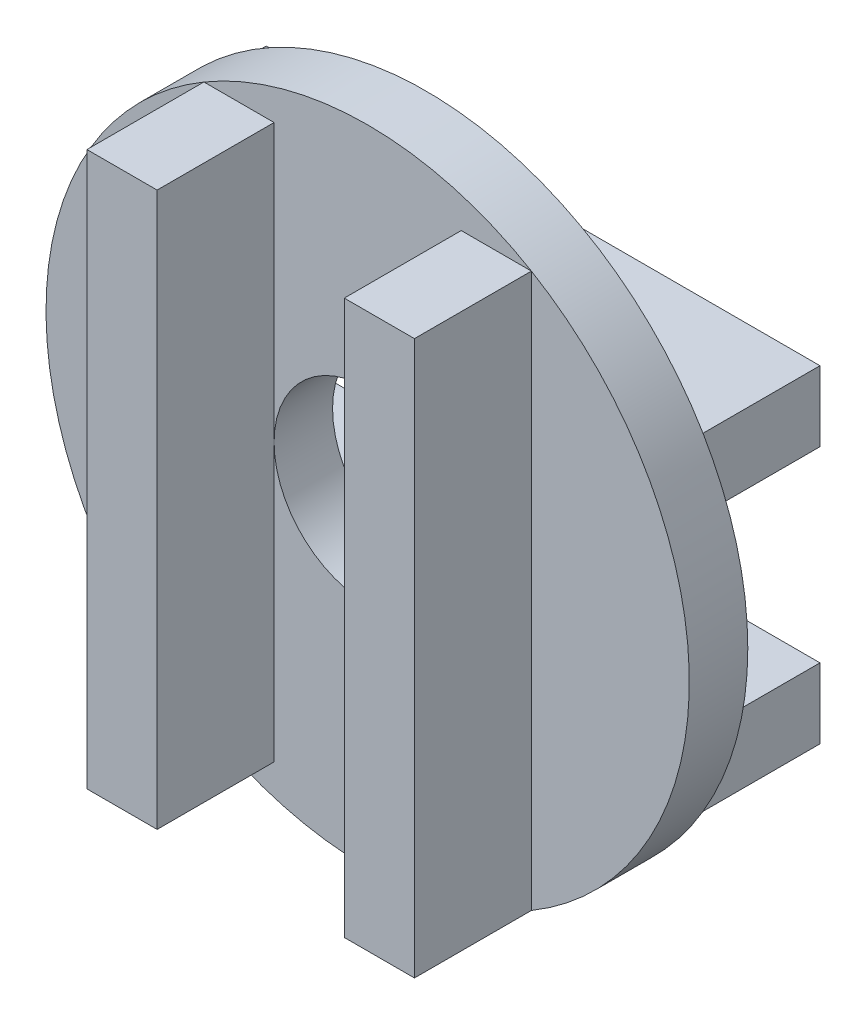
from build123d import *

# Parameters (mm, degrees)
SZKIC1_R                    = 55
SZKIC1_R_2                  = 16
DODANIE_WYCI_GNI_CIE1_DEPTH = 10
SZKIC2_W                    = 12
SZKIC2_H                    = 94.678403028
DODANIE_WYCI_GNI_CIE2_DEPTH = 20
SZKIC3_W                    = 94.678403028
SZKIC3_H                    = 12
DODANIE_WYCI_GNI_CIE3_DEPTH = 20


with BuildPart() as part:
    # Szkic1 → Dodanie-wyciągnięcie1 (new body)
    with BuildSketch(Plane.XY):
        Circle(SZKIC1_R)
        Circle(SZKIC1_R_2, mode=Mode.SUBTRACT)
    extrude(amount=DODANIE_WYCI_GNI_CIE1_DEPTH)

    # Szkic2 → Dodanie-wyciągnięcie2 (add)
    with BuildSketch(Plane.XY.offset(10)):
        with Locations((-22, 0)):
            Rectangle(SZKIC2_W, SZKIC2_H)
        with Locations((22, 0)):
            Rectangle(SZKIC2_W, SZKIC2_H)
    extrude(amount=DODANIE_WYCI_GNI_CIE2_DEPTH)

    # Szkic3 → Dodanie-wyciągnięcie3 (add)
    with BuildSketch(Plane(origin=(0, 0, 0), x_dir=(-1, 0, 0), z_dir=(0, 0, -1))):
        with Locations((0, -22)):
            Rectangle(SZKIC3_W, SZKIC3_H)
        with Locations((0, 22)):
            Rectangle(SZKIC3_W, SZKIC3_H)
    extrude(amount=DODANIE_WYCI_GNI_CIE3_DEPTH)


solid = part.part
